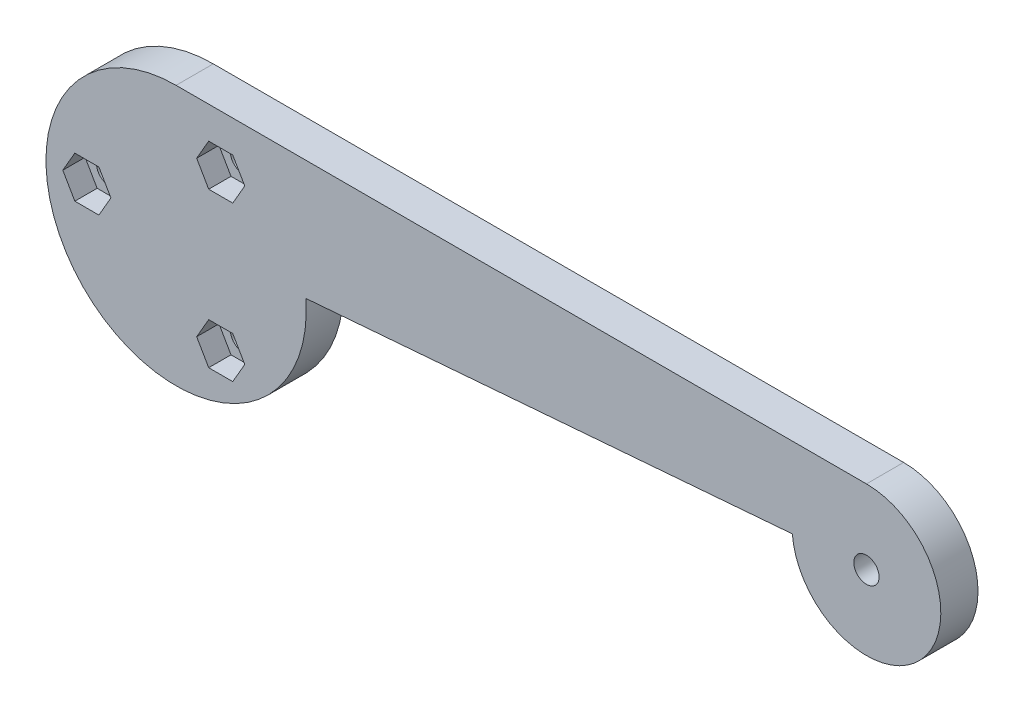
from build123d import *

# Parameters (mm, degrees)
BOSS_EXTRUDE1_DEPTH  = 5
M3_CLEARANCE_HOLE1_D = 3.4
CUT_EXTRUDE1_DEPTH   = 3
CIRPATTERN1_COUNT    = 3
M3_CLEARANCE_HOLE2_D = 3.4


with BuildPart() as part:
    # Sketch1 → Boss-Extrude1 (new body)
    with BuildSketch(Plane.XY):
        with BuildLine():
            Line((0, 17.5), (92.825687176, 17.5))
            ThreePointArc((92.825687176, 17.5), (100.175973433, 0.719639248), (82.858168684, 6.694658386))
            Line((82.858168684, 6.694658386), (17.443157361, 1.409347824))
            ThreePointArc((17.443157361, 1.409347824), (-11.865631317, -12.863000951), (0, 17.5))
        make_face()
    extrude(amount=BOSS_EXTRUDE1_DEPTH)

    # M3 Clearance Hole1 (through all)
    with Locations(Plane.XY.offset(5)):
        with Locations((-12, 0)):
            m3_clearance_hole1 = Hole(M3_CLEARANCE_HOLE1_D / 2)

    # Sketch8 → Cut-Extrude1 (cut)
    with BuildSketch(Plane.XY.offset(5)):
        Polygon((-10.383419246, 2.8), (-13.616580754, 2.8), (-15.233161507, 0), (-13.616580754, -2.8), (-10.383419246, -2.8), (-8.766838493, 0), align=None)
    cut_extrude1 = extrude(amount=-CUT_EXTRUDE1_DEPTH, mode=Mode.SUBTRACT)

    # CirPattern1: M3 Clearance Hole1, Cut-Extrude1 ×3 about axis
    cirpattern1_axis = Axis((0, 0, 0), (0, 0, 1))
    add([m3_clearance_hole1.rotate(cirpattern1_axis, i * 360 / CIRPATTERN1_COUNT) for i in range(1, CIRPATTERN1_COUNT)], mode=Mode.SUBTRACT)
    add([cut_extrude1.rotate(cirpattern1_axis, i * 360 / CIRPATTERN1_COUNT) for i in range(1, CIRPATTERN1_COUNT)], mode=Mode.SUBTRACT)

    # M3 Clearance Hole2 (through all)
    with Locations(Plane.XY.offset(5)):
        with Locations((92.825687176, 7.5)):
            Hole(M3_CLEARANCE_HOLE2_D / 2)


solid = part.part
